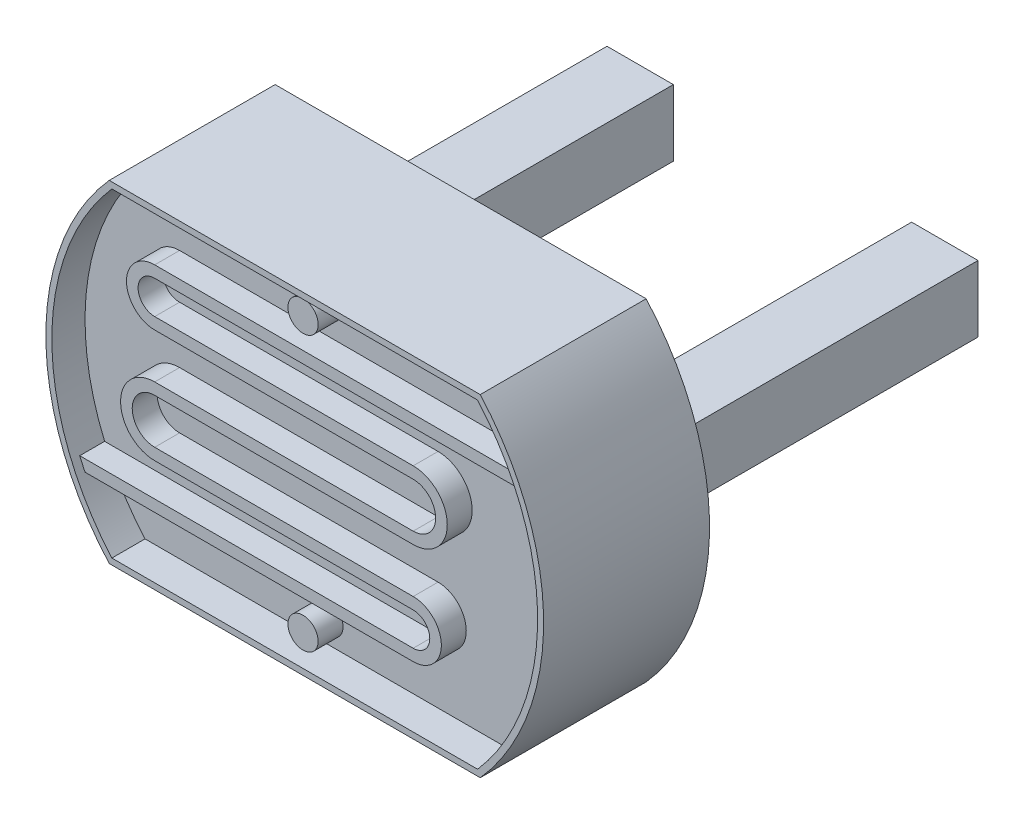
from build123d import *

# Parameters (mm, degrees)
BOSS_EXTRUDE1_DEPTH = 8
SKETCH2_W           = 4
SKETCH2_H           = 4
BOSS_EXTRUDE2_DEPTH = 20
BOSS_EXTRUDE3_DEPTH = 2
SKETCH4_R           = 0.91109378
BOSS_EXTRUDE4_DEPTH = 1.5


with BuildPart() as part:
    # Sketch1 → Boss-Extrude1 (new body)
    with BuildSketch(Plane.XY):
        with BuildLine():
            Line((-11.180339887, 10), (11.180339887, 10))
            ThreePointArc((11.180339887, 10), (15, 0), (11.180339887, -10))
            Line((11.180339887, -10), (-11.180339887, -10))
            ThreePointArc((-11.180339887, -10), (-15, 0), (-11.180339887, 10))
        make_face()
    extrude(amount=BOSS_EXTRUDE1_DEPTH)

    # Sketch2 → Boss-Extrude2 (add)
    with BuildSketch(Plane(origin=(0, 0, 0), x_dir=(-1, 0, 0), z_dir=(0, 0, -1))):
        with Locations((-9.180339887, 0)):
            Rectangle(SKETCH2_W, SKETCH2_H)
        Polygon((7.180339887, 2), (7.180339887, -2), (11.180339887, -2), (11.180339887, 0), (11.180339887, 2), align=None)
    extrude(amount=BOSS_EXTRUDE2_DEPTH)

    # Sketch3 → Boss-Extrude3 (add)
    with BuildSketch(Plane.XY.offset(8)):
        with BuildLine():
            Line((-11.180339887, -10), (11.180339887, -10))
            ThreePointArc((11.180339887, -10), (15, 0), (11.180339887, 10))
            Line((11.180339887, 10), (-11.180339887, 10))
            ThreePointArc((-11.180339887, 10), (-15, 0), (-11.180339887, -10))
        make_face()
        with BuildLine():
            ThreePointArc((-11.021413403, 9.634230221), (-14.638645612, 0), (-11.021413403, -9.634230221))
            Line((-11.021413403, -9.634230221), (11.021413403, -9.634230221))
            ThreePointArc((11.021413403, -9.634230221), (14.638645612, 0), (11.021413403, 9.634230221))
            Line((11.021413403, 9.634230221), (-11.021413403, 9.634230221))
        make_face(mode=Mode.SUBTRACT)
    extrude(amount=BOSS_EXTRUDE3_DEPTH)

    # Sketch4 → Boss-Extrude4 (add)
    with BuildSketch(Plane.XY.offset(8)):
        with Locations((0, 8.266858506)):
            Circle(SKETCH4_R)
        with Locations(Location((0, -8.266858506, 0), (0, 0, 180))):
            Circle(SKETCH4_R)
        with BuildLine():
            Line((13.1358141, 6.460675915), (-8.940009027, 6.460675915))
            ThreePointArc((-8.940009027, 6.460675915), (-10.640009027, 4.760675915), (-8.940009027, 3.060675915))
            Line((-8.940009027, 3.060675915), (6.638090535, 3.060675915))
            ThreePointArc((6.638090535, 3.060675915), (7.993428493, 1.705337957), (6.638090535, 0.35))
            Line((6.638090535, 0.35), (-8.940009027, 0.35))
            ThreePointArc((-8.940009027, 0.35), (-10.995346985, -1.705337957), (-8.940009027, -3.760675915))
            Line((-8.940009027, -3.760675915), (6.638090535, -3.760675915))
            ThreePointArc((6.638090535, -3.760675915), (7.638090535, -4.760675915), (6.638090535, -5.760675915))
            Line((6.638090535, -5.760675915), (-8.940009027, -5.760675915))
            Line((-8.940009027, -5.760675915), (-13.457509367, -5.760675915))
            ThreePointArc((-13.457509367, -5.760675915), (-13.301267355, -6.112792496), (-13.1358141, -6.460675915))
            Line((-13.1358141, -6.460675915), (-8.940009027, -6.460675915))
            Line((-8.940009027, -6.460675915), (6.638090535, -6.460675915))
            ThreePointArc((6.638090535, -6.460675915), (8.338090535, -4.760675915), (6.638090535, -3.060675915))
            Line((6.638090535, -3.060675915), (-8.940009027, -3.060675915))
            ThreePointArc((-8.940009027, -3.060675915), (-10.295346985, -1.705337957), (-8.940009027, -0.35))
            Line((-8.940009027, -0.35), (6.638090535, -0.35))
            ThreePointArc((6.638090535, -0.35), (8.693428493, 1.705337957), (6.638090535, 3.760675915))
            Line((6.638090535, 3.760675915), (-8.940009027, 3.760675915))
            ThreePointArc((-8.940009027, 3.760675915), (-9.940009027, 4.760675915), (-8.940009027, 5.760675915))
            Line((-8.940009027, 5.760675915), (13.457509367, 5.760675915))
            ThreePointArc((13.457509367, 5.760675915), (13.301267355, 6.112792496), (13.1358141, 6.460675915))
        make_face()
    extrude(amount=BOSS_EXTRUDE4_DEPTH)


solid = part.part
